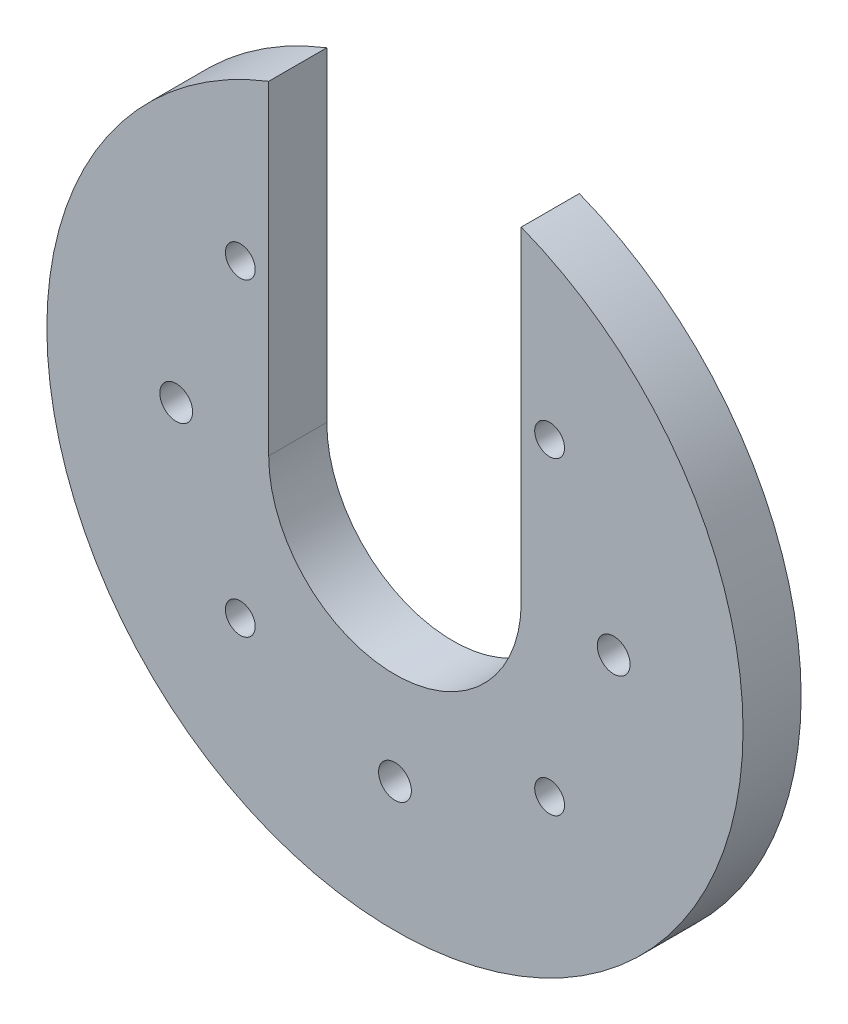
from build123d import *

# Parameters (mm, degrees)
SKETCH1_R           = 1.65
BOSS_EXTRUDE1_DEPTH = 5.842
SKETCH2_R           = 1.5
CUT_EXTRUDE1_DEPTH  = 50.860559066


with BuildPart() as part:
    # Sketch1 → Boss-Extrude1 (new body)
    with BuildSketch(Plane.XY):
        with BuildLine():
            Line((-12.7, 0), (-12.7, 32.629483496))
            ThreePointArc((-12.7, 32.629483496), (0, -35.0139), (12.7, 32.629483496))
            Line((12.7, 32.629483496), (12.7, 0))
            ThreePointArc((12.7, 0), (0, -12.7), (-12.7, 0))
        make_face()
        with Locations((22, 0)):
            Circle(SKETCH1_R, mode=Mode.SUBTRACT)
        with Locations((0, -22)):
            Circle(SKETCH1_R, mode=Mode.SUBTRACT)
        with Locations((-22, 0)):
            Circle(SKETCH1_R, mode=Mode.SUBTRACT)
    extrude(amount=BOSS_EXTRUDE1_DEPTH)

    # Sketch2 → Cut-Extrude1 (cut, through all)
    with BuildSketch(Plane.XY.offset(5.842)):
        with Locations((-15.556349186, -15.556349186)):
            Circle(SKETCH2_R)
        with Locations((-15.556349186, 15.556349186)):
            Circle(SKETCH2_R)
        with Locations((15.556349186, 15.556349186)):
            Circle(SKETCH2_R)
        with Locations((15.556349186, -15.556349186)):
            Circle(SKETCH2_R)
    extrude(amount=-CUT_EXTRUDE1_DEPTH, mode=Mode.SUBTRACT)


solid = part.part
